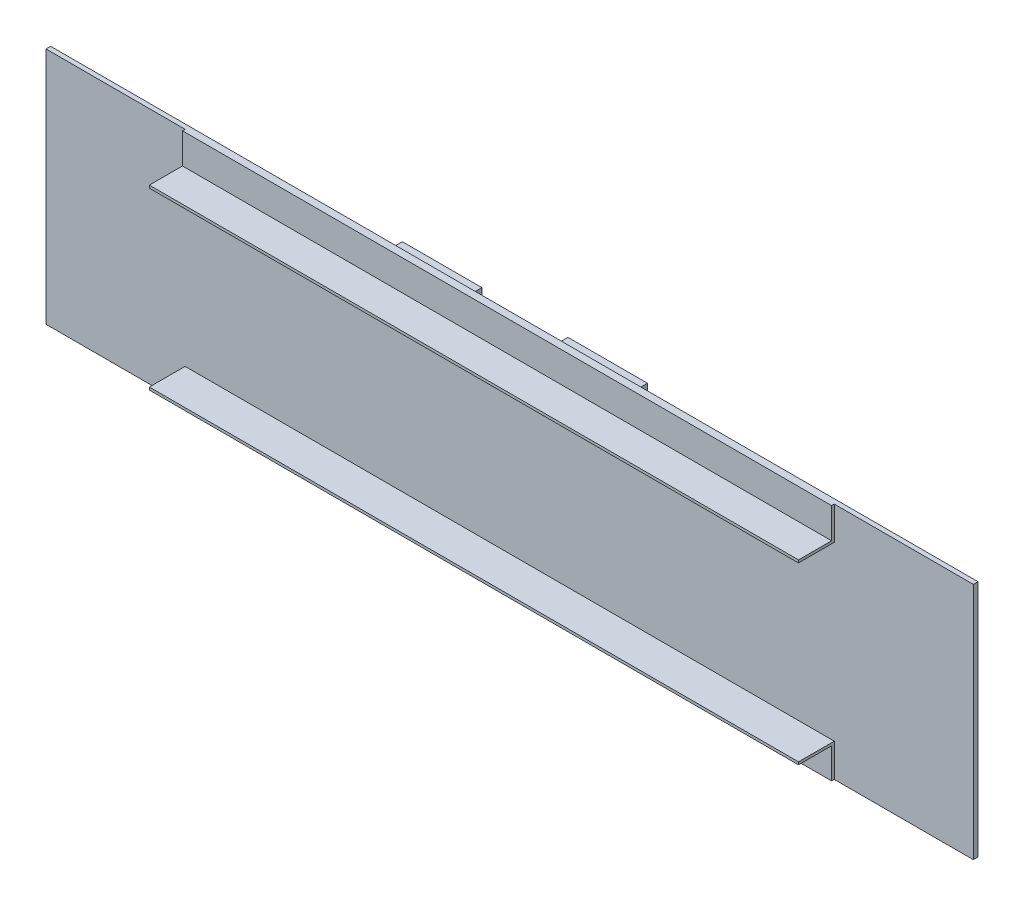
from build123d import *

# Parameters (mm, degrees)
SKETCH_1_W                  = 2800
SKETCH_1_H                  = 720
EXTRUDE_1_DEPTH             = 14
SKETCH_3_R                  = 13
CUT_EXTRUDE_1_DEPTH         = 1446.612672883
PATTERN_LINEAR_1_COUNT      = 3
PATTERN_LINEAR_1_PITCH      = 80
PATTERN_LINEAR_1_COUNT_DIR2 = 4
PATTERN_LINEAR_1_PITCH_DIR2 = 80
SKETCH_4_R                  = 13
CUT_EXTRUDE_2_DEPTH         = 1446.612672883
PATTERN_LINEAR_2_COUNT      = 2
PATTERN_LINEAR_2_PITCH      = 80
MIRROR_1_COPY_1_SKETCH_R    = 13
MIRROR_1_COPY_1_DEPTH       = 1446.612672883
MIRROR_1_COPY_2_SKETCH_R    = 13
MIRROR_1_COPY_2_DEPTH       = 1446.612672883
MIRROR_1_COPY_3_SKETCH_R    = 13
MIRROR_1_COPY_3_DEPTH       = 1446.612672883
MIRROR_1_COPY_4_SKETCH_R    = 13
MIRROR_1_COPY_4_DEPTH       = 1446.612672883
MIRROR_1_COPY_5_SKETCH_R    = 13
MIRROR_1_COPY_5_DEPTH       = 1446.612672883
MIRROR_1_COPY_6_SKETCH_R    = 13
MIRROR_1_COPY_6_DEPTH       = 1446.612672883
MIRROR_1_COPY_7_SKETCH_R    = 13
MIRROR_1_COPY_7_DEPTH       = 1446.612672883
MIRROR_1_COPY_8_SKETCH_R    = 13
MIRROR_1_COPY_8_DEPTH       = 1446.612672883
MIRROR_1_COPY_9_SKETCH_R    = 13
MIRROR_1_COPY_9_DEPTH       = 1446.612672883
MIRROR_1_COPY_10_SKETCH_R   = 13
MIRROR_1_COPY_10_DEPTH      = 1446.612672883
MIRROR_1_COPY_11_SKETCH_R   = 13
MIRROR_1_COPY_11_DEPTH      = 1446.612672883
MIRROR_1_COPY_12_SKETCH_R   = 13
MIRROR_1_COPY_12_DEPTH      = 1446.612672883
MIRROR_2_COPY_1_SKETCH_R    = 13
MIRROR_2_COPY_1_DEPTH       = 1446.612672883
MIRROR_2_COPY_2_SKETCH_R    = 13
MIRROR_2_COPY_2_DEPTH       = 1446.612672883
MIRROR_2_COPY_3_SKETCH_R    = 13
MIRROR_2_COPY_3_DEPTH       = 1446.612672883
MIRROR_2_COPY_4_SKETCH_R    = 13
MIRROR_2_COPY_4_DEPTH       = 1446.612672883
MIRROR_2_COPY_5_SKETCH_R    = 13
MIRROR_2_COPY_5_DEPTH       = 1446.612672883
MIRROR_2_COPY_6_SKETCH_R    = 13
MIRROR_2_COPY_6_DEPTH       = 1446.612672883
MIRROR_2_COPY_7_SKETCH_R    = 13
MIRROR_2_COPY_7_DEPTH       = 1446.612672883
MIRROR_2_COPY_8_SKETCH_R    = 13
MIRROR_2_COPY_8_DEPTH       = 1446.612672883
MIRROR_2_COPY_9_SKETCH_R    = 13
MIRROR_2_COPY_9_DEPTH       = 1446.612672883
MIRROR_2_COPY_10_SKETCH_R   = 13
MIRROR_2_COPY_10_DEPTH      = 1446.612672883
MIRROR_2_COPY_11_SKETCH_R   = 13
MIRROR_2_COPY_11_DEPTH      = 1446.612672883
MIRROR_2_COPY_12_SKETCH_R   = 13
MIRROR_2_COPY_12_DEPTH      = 1446.612672883
MIRROR_2_COPY_13_SKETCH_R   = 13
MIRROR_2_COPY_13_DEPTH      = 1446.612672883
MIRROR_2_COPY_14_SKETCH_R   = 13
MIRROR_2_COPY_14_DEPTH      = 1446.612672883
MIRROR_2_COPY_15_SKETCH_R   = 13
MIRROR_2_COPY_15_DEPTH      = 1446.612672883
MIRROR_2_COPY_16_SKETCH_R   = 13
MIRROR_2_COPY_16_DEPTH      = 1446.612672883
MIRROR_2_COPY_17_SKETCH_R   = 13
MIRROR_2_COPY_17_DEPTH      = 1446.612672883
MIRROR_2_COPY_18_SKETCH_R   = 13
MIRROR_2_COPY_18_DEPTH      = 1446.612672883
MIRROR_2_COPY_19_SKETCH_R   = 13
MIRROR_2_COPY_19_DEPTH      = 1446.612672883
MIRROR_2_COPY_20_SKETCH_R   = 13
MIRROR_2_COPY_20_DEPTH      = 1446.612672883
MIRROR_2_COPY_21_SKETCH_R   = 13
MIRROR_2_COPY_21_DEPTH      = 1446.612672883
MIRROR_2_COPY_22_SKETCH_R   = 13
MIRROR_2_COPY_22_DEPTH      = 1446.612672883
MIRROR_2_COPY_23_SKETCH_R   = 13
MIRROR_2_COPY_23_DEPTH      = 1446.612672883
MIRROR_2_COPY_24_SKETCH_R   = 13
MIRROR_2_COPY_24_DEPTH      = 1446.612672883
MIRROR_2_COPY_25_SKETCH_R   = 13
MIRROR_2_COPY_25_DEPTH      = 1446.612672883
MIRROR_2_COPY_26_SKETCH_R   = 13
MIRROR_2_COPY_26_DEPTH      = 1446.612672883
SKETCH_5_W                  = 980
SKETCH_5_H                  = 100
EXTRUDE_2_DEPTH             = 8
SKETCH_7_R                  = 13
CUT_EXTRUDE_3_DEPTH         = 1446.712281196
PATTERN_LINEAR_3_COUNT      = 5
PATTERN_LINEAR_3_PITCH      = 80
SKETCH_8_R                  = 13
CUT_EXTRUDE_4_DEPTH         = 1446.712281196
SKETCH_9_W                  = 980
SKETCH_9_H                  = 8
EXTRUDE_3_DEPTH             = 100
MIRROR_3_COPY_1_SKETCH_R    = 13
MIRROR_3_COPY_1_DEPTH       = 1446.712281196
MIRROR_3_COPY_2_SKETCH_R    = 13
MIRROR_3_COPY_2_DEPTH       = 1446.712281196
MIRROR_3_COPY_3_SKETCH_R    = 13
MIRROR_3_COPY_3_DEPTH       = 1446.712281196
MIRROR_3_COPY_4_SKETCH_R    = 13
MIRROR_3_COPY_4_DEPTH       = 1446.712281196
MIRROR_4_COPY_1_SKETCH_R    = 13
MIRROR_4_COPY_1_DEPTH       = 1446.712281196
MIRROR_4_COPY_2_SKETCH_R    = 13
MIRROR_4_COPY_2_DEPTH       = 1446.712281196
MIRROR_4_COPY_3_SKETCH_R    = 13
MIRROR_4_COPY_3_DEPTH       = 1446.712281196
MIRROR_4_COPY_4_SKETCH_R    = 13
MIRROR_4_COPY_4_DEPTH       = 1446.712281196
MIRROR_4_COPY_5_SKETCH_W    = 980
MIRROR_4_COPY_5_SKETCH_H    = 100
MIRROR_4_COPY_5_DEPTH       = 8
MIRROR_4_COPY_6_SKETCH_R    = 13
MIRROR_4_COPY_6_DEPTH       = 1446.712281196
MIRROR_4_COPY_7_SKETCH_R    = 13
MIRROR_4_COPY_7_DEPTH       = 1446.712281196
MIRROR_4_COPY_8_SKETCH_W    = 980
MIRROR_4_COPY_8_SKETCH_H    = 8
MIRROR_4_COPY_8_DEPTH       = 100
MIRROR_4_COPY_9_SKETCH_R    = 13
MIRROR_4_COPY_9_DEPTH       = 1446.712281196
MIRROR_4_COPY_10_SKETCH_R   = 13
MIRROR_4_COPY_10_DEPTH      = 1446.712281196
MIRROR_4_COPY_11_SKETCH_R   = 13
MIRROR_4_COPY_11_DEPTH      = 1446.712281196
MIRROR_4_COPY_12_SKETCH_R   = 13
MIRROR_4_COPY_12_DEPTH      = 1446.712281196
SKETCH_11_W                 = 240
SKETCH_11_H                 = 80
EXTRUDE_4_DEPTH             = 32
SKETCH_12_R                 = 13
CUT_EXTRUDE_5_DEPTH         = 1449.999654934
PATTERN_LINEAR_4_COUNT      = 3
PATTERN_LINEAR_4_PITCH      = 80
SKETCH_11_3_W               = 240
SKETCH_11_3_H               = 80
EXTRUDE_6_DEPTH             = 54
SKETCH_13_R                 = 13
CUT_EXTRUDE_6_DEPTH         = 1449.999654934
PATTERN_LINEAR_5_COUNT      = 3
PATTERN_LINEAR_5_PITCH      = 80
MIRROR_7_COPY_1_SKETCH_R    = 13
MIRROR_7_COPY_1_DEPTH       = 1449.999654934
MIRROR_7_COPY_2_SKETCH_R    = 13
MIRROR_7_COPY_2_DEPTH       = 1449.999654934
MIRROR_8_COPY_1_SKETCH_R    = 13
MIRROR_8_COPY_1_DEPTH       = 1449.999654934
MIRROR_8_COPY_2_SKETCH_R    = 13
MIRROR_8_COPY_2_DEPTH       = 1449.999654934
MIRROR_8_COPY_3_SKETCH_W    = 240
MIRROR_8_COPY_3_SKETCH_H    = 80
MIRROR_8_COPY_3_DEPTH       = 54
MIRROR_8_COPY_4_SKETCH_R    = 13
MIRROR_8_COPY_4_DEPTH       = 1449.999654934
MIRROR_8_COPY_5_SKETCH_R    = 13
MIRROR_8_COPY_5_DEPTH       = 1449.999654934
MIRROR_8_COPY_6_SKETCH_R    = 13
MIRROR_8_COPY_6_DEPTH       = 1449.999654934
SKETCH_14_W                 = 2800
SKETCH_14_H                 = 720
EXTRUDE_7_DEPTH             = 14
SKETCH_15_W                 = 1960
SKETCH_15_H                 = 100
EXTRUDE_8_DEPTH             = 8
SKETCH_16_W                 = 240
SKETCH_16_H                 = 80
EXTRUDE_9_DEPTH             = 32


with BuildPart() as part:
    # 草图1 → 凸台-拉伸1 (new body)
    with BuildSketch(Plane.XY):
        Rectangle(SKETCH_1_W, SKETCH_1_H)
    extrude(amount=EXTRUDE_1_DEPTH)

    # 草图3 → 切除-拉伸1 (cut, through all)
    with BuildSketch(Plane.XY.offset(14)):
        with Locations((-1330.210648338, 299.636572569)):
            Circle(SKETCH_3_R)
    cut_extrude_1 = extrude(amount=-CUT_EXTRUDE_1_DEPTH, mode=Mode.SUBTRACT)

    # 阵列(线性)1: Cut-Extrude 1 3 × 4
    with Locations(*[(i * PATTERN_LINEAR_1_PITCH, -j * PATTERN_LINEAR_1_PITCH_DIR2, 0) for i in range(PATTERN_LINEAR_1_COUNT) for j in range(PATTERN_LINEAR_1_COUNT_DIR2) if (i, j) != (0, 0)]):
        add(cut_extrude_1, mode=Mode.SUBTRACT)

    # 草图4 → 切除-拉伸2 (cut, through all)
    with BuildSketch(Plane.XY.offset(14)):
        with Locations((-1030.029167404, 300.016103943)):
            Circle(SKETCH_4_R)
    cut_extrude_2 = extrude(amount=-CUT_EXTRUDE_2_DEPTH, mode=Mode.SUBTRACT)

    # 阵列(线性)2: 切除-拉伸2 ×2
    with Locations(*[(0, -i * PATTERN_LINEAR_2_PITCH, 0) for i in range(1, PATTERN_LINEAR_2_COUNT)]):
        add(cut_extrude_2, mode=Mode.SUBTRACT)

    # 镜向1: 切除-拉伸1, 切除-拉伸2 across plane
    add(cut_extrude_1.mirror(Plane.ZX), mode=Mode.SUBTRACT)
    add(cut_extrude_2.mirror(Plane.ZX), mode=Mode.SUBTRACT)

    # 镜向1 copy 1 sketch → 镜向1 copy 1 (cut, through all)
    with BuildSketch(Plane(origin=(0, 80, 14), x_dir=(1, 0, 0), z_dir=(0, 0, 1))):
        with Locations((-1330.210648338, -299.636572569)):
            Circle(MIRROR_1_COPY_1_SKETCH_R)
    extrude(amount=-MIRROR_1_COPY_1_DEPTH, mode=Mode.SUBTRACT)

    # 镜向1 copy 2 sketch → 镜向1 copy 2 (cut, through all)
    with BuildSketch(Plane(origin=(0, 160, 14), x_dir=(1, 0, 0), z_dir=(0, 0, 1))):
        with Locations((-1330.210648338, -299.636572569)):
            Circle(MIRROR_1_COPY_2_SKETCH_R)
    extrude(amount=-MIRROR_1_COPY_2_DEPTH, mode=Mode.SUBTRACT)

    # 镜向1 copy 3 sketch → 镜向1 copy 3 (cut, through all)
    with BuildSketch(Plane(origin=(0, 240, 14), x_dir=(1, 0, 0), z_dir=(0, 0, 1))):
        with Locations((-1330.210648338, -299.636572569)):
            Circle(MIRROR_1_COPY_3_SKETCH_R)
    extrude(amount=-MIRROR_1_COPY_3_DEPTH, mode=Mode.SUBTRACT)

    # 镜向1 copy 4 sketch → 镜向1 copy 4 (cut, through all)
    with BuildSketch(Plane(origin=(80, 0, 14), x_dir=(1, 0, 0), z_dir=(0, 0, 1))):
        with Locations((-1330.210648338, -299.636572569)):
            Circle(MIRROR_1_COPY_4_SKETCH_R)
    extrude(amount=-MIRROR_1_COPY_4_DEPTH, mode=Mode.SUBTRACT)

    # 镜向1 copy 5 sketch → 镜向1 copy 5 (cut, through all)
    with BuildSketch(Plane(origin=(80, 80, 14), x_dir=(1, 0, 0), z_dir=(0, 0, 1))):
        with Locations((-1330.210648338, -299.636572569)):
            Circle(MIRROR_1_COPY_5_SKETCH_R)
    extrude(amount=-MIRROR_1_COPY_5_DEPTH, mode=Mode.SUBTRACT)

    # 镜向1 copy 6 sketch → 镜向1 copy 6 (cut, through all)
    with BuildSketch(Plane(origin=(80, 160, 14), x_dir=(1, 0, 0), z_dir=(0, 0, 1))):
        with Locations((-1330.210648338, -299.636572569)):
            Circle(MIRROR_1_COPY_6_SKETCH_R)
    extrude(amount=-MIRROR_1_COPY_6_DEPTH, mode=Mode.SUBTRACT)

    # 镜向1 copy 7 sketch → 镜向1 copy 7 (cut, through all)
    with BuildSketch(Plane(origin=(80, 240, 14), x_dir=(1, 0, 0), z_dir=(0, 0, 1))):
        with Locations((-1330.210648338, -299.636572569)):
            Circle(MIRROR_1_COPY_7_SKETCH_R)
    extrude(amount=-MIRROR_1_COPY_7_DEPTH, mode=Mode.SUBTRACT)

    # 镜向1 copy 8 sketch → 镜向1 copy 8 (cut, through all)
    with BuildSketch(Plane(origin=(160, 0, 14), x_dir=(1, 0, 0), z_dir=(0, 0, 1))):
        with Locations((-1330.210648338, -299.636572569)):
            Circle(MIRROR_1_COPY_8_SKETCH_R)
    extrude(amount=-MIRROR_1_COPY_8_DEPTH, mode=Mode.SUBTRACT)

    # 镜向1 copy 9 sketch → 镜向1 copy 9 (cut, through all)
    with BuildSketch(Plane(origin=(160, 80, 14), x_dir=(1, 0, 0), z_dir=(0, 0, 1))):
        with Locations((-1330.210648338, -299.636572569)):
            Circle(MIRROR_1_COPY_9_SKETCH_R)
    extrude(amount=-MIRROR_1_COPY_9_DEPTH, mode=Mode.SUBTRACT)

    # 镜向1 copy 10 sketch → 镜向1 copy 10 (cut, through all)
    with BuildSketch(Plane(origin=(160, 160, 14), x_dir=(1, 0, 0), z_dir=(0, 0, 1))):
        with Locations((-1330.210648338, -299.636572569)):
            Circle(MIRROR_1_COPY_10_SKETCH_R)
    extrude(amount=-MIRROR_1_COPY_10_DEPTH, mode=Mode.SUBTRACT)

    # 镜向1 copy 11 sketch → 镜向1 copy 11 (cut, through all)
    with BuildSketch(Plane(origin=(160, 240, 14), x_dir=(1, 0, 0), z_dir=(0, 0, 1))):
        with Locations((-1330.210648338, -299.636572569)):
            Circle(MIRROR_1_COPY_11_SKETCH_R)
    extrude(amount=-MIRROR_1_COPY_11_DEPTH, mode=Mode.SUBTRACT)

    # 镜向1 copy 12 sketch → 镜向1 copy 12 (cut, through all)
    with BuildSketch(Plane(origin=(0, 80, 14), x_dir=(1, 0, 0), z_dir=(0, 0, 1))):
        with Locations((-1030.029167404, -300.016103943)):
            Circle(MIRROR_1_COPY_12_SKETCH_R)
    extrude(amount=-MIRROR_1_COPY_12_DEPTH, mode=Mode.SUBTRACT)

    # 镜向2: 切除-拉伸1, 切除-拉伸2 across plane
    add(cut_extrude_1.mirror(Plane(origin=(0, 0, 0), x_dir=(0, 0, 1), z_dir=(1, 0, 0))), mode=Mode.SUBTRACT)
    add(cut_extrude_2.mirror(Plane(origin=(0, 0, 0), x_dir=(0, 0, 1), z_dir=(1, 0, 0))), mode=Mode.SUBTRACT)

    # 镜向2 copy 1 sketch → 镜向2 copy 1 (cut, through all)
    with BuildSketch(Plane(origin=(0, -80, 14), x_dir=(-1, 0, 0), z_dir=(0, 0, 1))):
        with Locations((-1330.210648338, -299.636572569)):
            Circle(MIRROR_2_COPY_1_SKETCH_R)
    extrude(amount=-MIRROR_2_COPY_1_DEPTH, mode=Mode.SUBTRACT)

    # 镜向2 copy 2 sketch → 镜向2 copy 2 (cut, through all)
    with BuildSketch(Plane(origin=(0, -160, 14), x_dir=(-1, 0, 0), z_dir=(0, 0, 1))):
        with Locations((-1330.210648338, -299.636572569)):
            Circle(MIRROR_2_COPY_2_SKETCH_R)
    extrude(amount=-MIRROR_2_COPY_2_DEPTH, mode=Mode.SUBTRACT)

    # 镜向2 copy 3 sketch → 镜向2 copy 3 (cut, through all)
    with BuildSketch(Plane(origin=(0, -240, 14), x_dir=(-1, 0, 0), z_dir=(0, 0, 1))):
        with Locations((-1330.210648338, -299.636572569)):
            Circle(MIRROR_2_COPY_3_SKETCH_R)
    extrude(amount=-MIRROR_2_COPY_3_DEPTH, mode=Mode.SUBTRACT)

    # 镜向2 copy 4 sketch → 镜向2 copy 4 (cut, through all)
    with BuildSketch(Plane(origin=(-80, 0, 14), x_dir=(-1, 0, 0), z_dir=(0, 0, 1))):
        with Locations((-1330.210648338, -299.636572569)):
            Circle(MIRROR_2_COPY_4_SKETCH_R)
    extrude(amount=-MIRROR_2_COPY_4_DEPTH, mode=Mode.SUBTRACT)

    # 镜向2 copy 5 sketch → 镜向2 copy 5 (cut, through all)
    with BuildSketch(Plane(origin=(-80, -80, 14), x_dir=(-1, 0, 0), z_dir=(0, 0, 1))):
        with Locations((-1330.210648338, -299.636572569)):
            Circle(MIRROR_2_COPY_5_SKETCH_R)
    extrude(amount=-MIRROR_2_COPY_5_DEPTH, mode=Mode.SUBTRACT)

    # 镜向2 copy 6 sketch → 镜向2 copy 6 (cut, through all)
    with BuildSketch(Plane(origin=(-80, -160, 14), x_dir=(-1, 0, 0), z_dir=(0, 0, 1))):
        with Locations((-1330.210648338, -299.636572569)):
            Circle(MIRROR_2_COPY_6_SKETCH_R)
    extrude(amount=-MIRROR_2_COPY_6_DEPTH, mode=Mode.SUBTRACT)

    # 镜向2 copy 7 sketch → 镜向2 copy 7 (cut, through all)
    with BuildSketch(Plane(origin=(-80, -240, 14), x_dir=(-1, 0, 0), z_dir=(0, 0, 1))):
        with Locations((-1330.210648338, -299.636572569)):
            Circle(MIRROR_2_COPY_7_SKETCH_R)
    extrude(amount=-MIRROR_2_COPY_7_DEPTH, mode=Mode.SUBTRACT)

    # 镜向2 copy 8 sketch → 镜向2 copy 8 (cut, through all)
    with BuildSketch(Plane(origin=(-160, 0, 14), x_dir=(-1, 0, 0), z_dir=(0, 0, 1))):
        with Locations((-1330.210648338, -299.636572569)):
            Circle(MIRROR_2_COPY_8_SKETCH_R)
    extrude(amount=-MIRROR_2_COPY_8_DEPTH, mode=Mode.SUBTRACT)

    # 镜向2 copy 9 sketch → 镜向2 copy 9 (cut, through all)
    with BuildSketch(Plane(origin=(-160, -80, 14), x_dir=(-1, 0, 0), z_dir=(0, 0, 1))):
        with Locations((-1330.210648338, -299.636572569)):
            Circle(MIRROR_2_COPY_9_SKETCH_R)
    extrude(amount=-MIRROR_2_COPY_9_DEPTH, mode=Mode.SUBTRACT)

    # 镜向2 copy 10 sketch → 镜向2 copy 10 (cut, through all)
    with BuildSketch(Plane(origin=(-160, -160, 14), x_dir=(-1, 0, 0), z_dir=(0, 0, 1))):
        with Locations((-1330.210648338, -299.636572569)):
            Circle(MIRROR_2_COPY_10_SKETCH_R)
    extrude(amount=-MIRROR_2_COPY_10_DEPTH, mode=Mode.SUBTRACT)

    # 镜向2 copy 11 sketch → 镜向2 copy 11 (cut, through all)
    with BuildSketch(Plane(origin=(-160, -240, 14), x_dir=(-1, 0, 0), z_dir=(0, 0, 1))):
        with Locations((-1330.210648338, -299.636572569)):
            Circle(MIRROR_2_COPY_11_SKETCH_R)
    extrude(amount=-MIRROR_2_COPY_11_DEPTH, mode=Mode.SUBTRACT)

    # 镜向2 copy 12 sketch → 镜向2 copy 12 (cut, through all)
    with BuildSketch(Plane(origin=(0, -80, 14), x_dir=(-1, 0, 0), z_dir=(0, 0, 1))):
        with Locations((-1030.029167404, -300.016103943)):
            Circle(MIRROR_2_COPY_12_SKETCH_R)
    extrude(amount=-MIRROR_2_COPY_12_DEPTH, mode=Mode.SUBTRACT)

    # 镜向2 copy 13 sketch → 镜向2 copy 13 (cut, through all)
    with BuildSketch(Plane(origin=(0, 0, 14), x_dir=(-1, 0, 0), z_dir=(0, 0, 1))):
        with Locations((-1330.210648338, 299.636572569)):
            Circle(MIRROR_2_COPY_13_SKETCH_R)
    extrude(amount=-MIRROR_2_COPY_13_DEPTH, mode=Mode.SUBTRACT)

    # 镜向2 copy 14 sketch → 镜向2 copy 14 (cut, through all)
    with BuildSketch(Plane(origin=(0, 0, 14), x_dir=(-1, 0, 0), z_dir=(0, 0, 1))):
        with Locations((-1030.029167404, 300.016103943)):
            Circle(MIRROR_2_COPY_14_SKETCH_R)
    extrude(amount=-MIRROR_2_COPY_14_DEPTH, mode=Mode.SUBTRACT)

    # 镜向2 copy 15 sketch → 镜向2 copy 15 (cut, through all)
    with BuildSketch(Plane(origin=(0, 80, 14), x_dir=(-1, 0, 0), z_dir=(0, 0, 1))):
        with Locations((-1330.210648338, 299.636572569)):
            Circle(MIRROR_2_COPY_15_SKETCH_R)
    extrude(amount=-MIRROR_2_COPY_15_DEPTH, mode=Mode.SUBTRACT)

    # 镜向2 copy 16 sketch → 镜向2 copy 16 (cut, through all)
    with BuildSketch(Plane(origin=(0, 160, 14), x_dir=(-1, 0, 0), z_dir=(0, 0, 1))):
        with Locations((-1330.210648338, 299.636572569)):
            Circle(MIRROR_2_COPY_16_SKETCH_R)
    extrude(amount=-MIRROR_2_COPY_16_DEPTH, mode=Mode.SUBTRACT)

    # 镜向2 copy 17 sketch → 镜向2 copy 17 (cut, through all)
    with BuildSketch(Plane(origin=(0, 240, 14), x_dir=(-1, 0, 0), z_dir=(0, 0, 1))):
        with Locations((-1330.210648338, 299.636572569)):
            Circle(MIRROR_2_COPY_17_SKETCH_R)
    extrude(amount=-MIRROR_2_COPY_17_DEPTH, mode=Mode.SUBTRACT)

    # 镜向2 copy 18 sketch → 镜向2 copy 18 (cut, through all)
    with BuildSketch(Plane(origin=(-80, 0, 14), x_dir=(-1, 0, 0), z_dir=(0, 0, 1))):
        with Locations((-1330.210648338, 299.636572569)):
            Circle(MIRROR_2_COPY_18_SKETCH_R)
    extrude(amount=-MIRROR_2_COPY_18_DEPTH, mode=Mode.SUBTRACT)

    # 镜向2 copy 19 sketch → 镜向2 copy 19 (cut, through all)
    with BuildSketch(Plane(origin=(-80, 80, 14), x_dir=(-1, 0, 0), z_dir=(0, 0, 1))):
        with Locations((-1330.210648338, 299.636572569)):
            Circle(MIRROR_2_COPY_19_SKETCH_R)
    extrude(amount=-MIRROR_2_COPY_19_DEPTH, mode=Mode.SUBTRACT)

    # 镜向2 copy 20 sketch → 镜向2 copy 20 (cut, through all)
    with BuildSketch(Plane(origin=(-80, 160, 14), x_dir=(-1, 0, 0), z_dir=(0, 0, 1))):
        with Locations((-1330.210648338, 299.636572569)):
            Circle(MIRROR_2_COPY_20_SKETCH_R)
    extrude(amount=-MIRROR_2_COPY_20_DEPTH, mode=Mode.SUBTRACT)

    # 镜向2 copy 21 sketch → 镜向2 copy 21 (cut, through all)
    with BuildSketch(Plane(origin=(-80, 240, 14), x_dir=(-1, 0, 0), z_dir=(0, 0, 1))):
        with Locations((-1330.210648338, 299.636572569)):
            Circle(MIRROR_2_COPY_21_SKETCH_R)
    extrude(amount=-MIRROR_2_COPY_21_DEPTH, mode=Mode.SUBTRACT)

    # 镜向2 copy 22 sketch → 镜向2 copy 22 (cut, through all)
    with BuildSketch(Plane(origin=(-160, 0, 14), x_dir=(-1, 0, 0), z_dir=(0, 0, 1))):
        with Locations((-1330.210648338, 299.636572569)):
            Circle(MIRROR_2_COPY_22_SKETCH_R)
    extrude(amount=-MIRROR_2_COPY_22_DEPTH, mode=Mode.SUBTRACT)

    # 镜向2 copy 23 sketch → 镜向2 copy 23 (cut, through all)
    with BuildSketch(Plane(origin=(-160, 80, 14), x_dir=(-1, 0, 0), z_dir=(0, 0, 1))):
        with Locations((-1330.210648338, 299.636572569)):
            Circle(MIRROR_2_COPY_23_SKETCH_R)
    extrude(amount=-MIRROR_2_COPY_23_DEPTH, mode=Mode.SUBTRACT)

    # 镜向2 copy 24 sketch → 镜向2 copy 24 (cut, through all)
    with BuildSketch(Plane(origin=(-160, 160, 14), x_dir=(-1, 0, 0), z_dir=(0, 0, 1))):
        with Locations((-1330.210648338, 299.636572569)):
            Circle(MIRROR_2_COPY_24_SKETCH_R)
    extrude(amount=-MIRROR_2_COPY_24_DEPTH, mode=Mode.SUBTRACT)

    # 镜向2 copy 25 sketch → 镜向2 copy 25 (cut, through all)
    with BuildSketch(Plane(origin=(-160, 240, 14), x_dir=(-1, 0, 0), z_dir=(0, 0, 1))):
        with Locations((-1330.210648338, 299.636572569)):
            Circle(MIRROR_2_COPY_25_SKETCH_R)
    extrude(amount=-MIRROR_2_COPY_25_DEPTH, mode=Mode.SUBTRACT)

    # 镜向2 copy 26 sketch → 镜向2 copy 26 (cut, through all)
    with BuildSketch(Plane(origin=(0, 80, 14), x_dir=(-1, 0, 0), z_dir=(0, 0, 1))):
        with Locations((-1030.029167404, 300.016103943)):
            Circle(MIRROR_2_COPY_26_SKETCH_R)
    extrude(amount=-MIRROR_2_COPY_26_DEPTH, mode=Mode.SUBTRACT)

    # 草图5 → 凸台-拉伸2 (add)
    with BuildSketch(Plane.XY.offset(14)):
        with Locations((-490, 310)):
            Rectangle(SKETCH_5_W, SKETCH_5_H)
    extrude_2 = extrude(amount=EXTRUDE_2_DEPTH)

    # 草图7 → 切除-拉伸3 (cut, through all)
    with BuildSketch(Plane.XY.offset(22)):
        with Locations((-930, 304)):
            Circle(SKETCH_7_R)
    cut_extrude_3 = extrude(amount=-CUT_EXTRUDE_3_DEPTH, mode=Mode.SUBTRACT)

    # 阵列(线性)3: 切除-拉伸3 ×5
    with Locations(*[(i * PATTERN_LINEAR_3_PITCH, 0, 0) for i in range(1, PATTERN_LINEAR_3_COUNT)]):
        add(cut_extrude_3, mode=Mode.SUBTRACT)

    # 草图8 → 切除-拉伸4 (cut, through all)
    with BuildSketch(Plane.XY.offset(22)):
        with Locations((-450, 304)):
            Circle(SKETCH_8_R)
        with Locations((-50, 304)):
            Circle(SKETCH_8_R)
    cut_extrude_4 = extrude(amount=-CUT_EXTRUDE_4_DEPTH, mode=Mode.SUBTRACT)

    # 草图9 → 凸台-拉伸3 (add)
    with BuildSketch(Plane.XY.offset(22)):
        with Locations((-490, 264)):
            Rectangle(SKETCH_9_W, SKETCH_9_H)
    extrude_3 = extrude(amount=EXTRUDE_3_DEPTH)

    # 镜向3: 凸台-拉伸2, 切除-拉伸3, 切除-拉伸4, 凸台-拉伸3 across plane
    add(extrude_2.mirror(Plane.ZX))
    add(cut_extrude_3.mirror(Plane.ZX), mode=Mode.SUBTRACT)
    add(cut_extrude_4.mirror(Plane.ZX), mode=Mode.SUBTRACT)
    add(extrude_3.mirror(Plane.ZX))

    # 镜向3 copy 1 sketch → 镜向3 copy 1 (cut, through all)
    with BuildSketch(Plane(origin=(80, 0, 22), x_dir=(1, 0, 0), z_dir=(0, 0, 1))):
        with Locations((-930, -304)):
            Circle(MIRROR_3_COPY_1_SKETCH_R)
    extrude(amount=-MIRROR_3_COPY_1_DEPTH, mode=Mode.SUBTRACT)

    # 镜向3 copy 2 sketch → 镜向3 copy 2 (cut, through all)
    with BuildSketch(Plane(origin=(160, 0, 22), x_dir=(1, 0, 0), z_dir=(0, 0, 1))):
        with Locations((-930, -304)):
            Circle(MIRROR_3_COPY_2_SKETCH_R)
    extrude(amount=-MIRROR_3_COPY_2_DEPTH, mode=Mode.SUBTRACT)

    # 镜向3 copy 3 sketch → 镜向3 copy 3 (cut, through all)
    with BuildSketch(Plane(origin=(240, 0, 22), x_dir=(1, 0, 0), z_dir=(0, 0, 1))):
        with Locations((-930, -304)):
            Circle(MIRROR_3_COPY_3_SKETCH_R)
    extrude(amount=-MIRROR_3_COPY_3_DEPTH, mode=Mode.SUBTRACT)

    # 镜向3 copy 4 sketch → 镜向3 copy 4 (cut, through all)
    with BuildSketch(Plane(origin=(320, 0, 22), x_dir=(1, 0, 0), z_dir=(0, 0, 1))):
        with Locations((-930, -304)):
            Circle(MIRROR_3_COPY_4_SKETCH_R)
    extrude(amount=-MIRROR_3_COPY_4_DEPTH, mode=Mode.SUBTRACT)

    # 镜向4: 凸台-拉伸2, 切除-拉伸3, 切除-拉伸4, 凸台-拉伸3 across plane
    add(extrude_2.mirror(Plane(origin=(0, 0, 0), x_dir=(0, 0, 1), z_dir=(1, 0, 0))))
    add(cut_extrude_3.mirror(Plane(origin=(0, 0, 0), x_dir=(0, 0, 1), z_dir=(1, 0, 0))), mode=Mode.SUBTRACT)
    add(cut_extrude_4.mirror(Plane(origin=(0, 0, 0), x_dir=(0, 0, 1), z_dir=(1, 0, 0))), mode=Mode.SUBTRACT)
    add(extrude_3.mirror(Plane(origin=(0, 0, 0), x_dir=(0, 0, 1), z_dir=(1, 0, 0))))

    # 镜向4 copy 1 sketch → 镜向4 copy 1 (cut, through all)
    with BuildSketch(Plane(origin=(-80, 0, 22), x_dir=(-1, 0, 0), z_dir=(0, 0, 1))):
        with Locations((-930, -304)):
            Circle(MIRROR_4_COPY_1_SKETCH_R)
    extrude(amount=-MIRROR_4_COPY_1_DEPTH, mode=Mode.SUBTRACT)

    # 镜向4 copy 2 sketch → 镜向4 copy 2 (cut, through all)
    with BuildSketch(Plane(origin=(-160, 0, 22), x_dir=(-1, 0, 0), z_dir=(0, 0, 1))):
        with Locations((-930, -304)):
            Circle(MIRROR_4_COPY_2_SKETCH_R)
    extrude(amount=-MIRROR_4_COPY_2_DEPTH, mode=Mode.SUBTRACT)

    # 镜向4 copy 3 sketch → 镜向4 copy 3 (cut, through all)
    with BuildSketch(Plane(origin=(-240, 0, 22), x_dir=(-1, 0, 0), z_dir=(0, 0, 1))):
        with Locations((-930, -304)):
            Circle(MIRROR_4_COPY_3_SKETCH_R)
    extrude(amount=-MIRROR_4_COPY_3_DEPTH, mode=Mode.SUBTRACT)

    # 镜向4 copy 4 sketch → 镜向4 copy 4 (cut, through all)
    with BuildSketch(Plane(origin=(-320, 0, 22), x_dir=(-1, 0, 0), z_dir=(0, 0, 1))):
        with Locations((-930, -304)):
            Circle(MIRROR_4_COPY_4_SKETCH_R)
    extrude(amount=-MIRROR_4_COPY_4_DEPTH, mode=Mode.SUBTRACT)

    # 镜向4 copy 5 sketch → 镜向4 copy 5 (add)
    with BuildSketch(Plane(origin=(0, 0, 14), x_dir=(-1, 0, 0), z_dir=(0, 0, 1))):
        with Locations((-490, 310)):
            Rectangle(MIRROR_4_COPY_5_SKETCH_W, MIRROR_4_COPY_5_SKETCH_H)
    extrude(amount=MIRROR_4_COPY_5_DEPTH)

    # 镜向4 copy 6 sketch → 镜向4 copy 6 (cut, through all)
    with BuildSketch(Plane(origin=(0, 0, 22), x_dir=(-1, 0, 0), z_dir=(0, 0, 1))):
        with Locations((-930, 304)):
            Circle(MIRROR_4_COPY_6_SKETCH_R)
    extrude(amount=-MIRROR_4_COPY_6_DEPTH, mode=Mode.SUBTRACT)

    # 镜向4 copy 7 sketch → 镜向4 copy 7 (cut, through all)
    with BuildSketch(Plane(origin=(0, 0, 22), x_dir=(-1, 0, 0), z_dir=(0, 0, 1))):
        with Locations((-450, 304)):
            Circle(MIRROR_4_COPY_7_SKETCH_R)
        with Locations((-50, 304)):
            Circle(MIRROR_4_COPY_7_SKETCH_R)
    extrude(amount=-MIRROR_4_COPY_7_DEPTH, mode=Mode.SUBTRACT)

    # 镜向4 copy 8 sketch → 镜向4 copy 8 (add)
    with BuildSketch(Plane(origin=(0, 0, 22), x_dir=(-1, 0, 0), z_dir=(0, 0, 1))):
        with Locations((-490, 264)):
            Rectangle(MIRROR_4_COPY_8_SKETCH_W, MIRROR_4_COPY_8_SKETCH_H)
    extrude(amount=MIRROR_4_COPY_8_DEPTH)

    # 镜向4 copy 9 sketch → 镜向4 copy 9 (cut, through all)
    with BuildSketch(Plane(origin=(-80, 0, 22), x_dir=(-1, 0, 0), z_dir=(0, 0, 1))):
        with Locations((-930, 304)):
            Circle(MIRROR_4_COPY_9_SKETCH_R)
    extrude(amount=-MIRROR_4_COPY_9_DEPTH, mode=Mode.SUBTRACT)

    # 镜向4 copy 10 sketch → 镜向4 copy 10 (cut, through all)
    with BuildSketch(Plane(origin=(-160, 0, 22), x_dir=(-1, 0, 0), z_dir=(0, 0, 1))):
        with Locations((-930, 304)):
            Circle(MIRROR_4_COPY_10_SKETCH_R)
    extrude(amount=-MIRROR_4_COPY_10_DEPTH, mode=Mode.SUBTRACT)

    # 镜向4 copy 11 sketch → 镜向4 copy 11 (cut, through all)
    with BuildSketch(Plane(origin=(-240, 0, 22), x_dir=(-1, 0, 0), z_dir=(0, 0, 1))):
        with Locations((-930, 304)):
            Circle(MIRROR_4_COPY_11_SKETCH_R)
    extrude(amount=-MIRROR_4_COPY_11_DEPTH, mode=Mode.SUBTRACT)

    # 镜向4 copy 12 sketch → 镜向4 copy 12 (cut, through all)
    with BuildSketch(Plane(origin=(-320, 0, 22), x_dir=(-1, 0, 0), z_dir=(0, 0, 1))):
        with Locations((-930, 304)):
            Circle(MIRROR_4_COPY_12_SKETCH_R)
    extrude(amount=-MIRROR_4_COPY_12_DEPTH, mode=Mode.SUBTRACT)

    # 草图11 → 凸台-拉伸4 (add)
    with BuildSketch(Plane.XY.offset(22)):
        with Locations((-250, 308)):
            Rectangle(SKETCH_11_W, SKETCH_11_H)
    extrude(amount=-EXTRUDE_4_DEPTH)

    # 草图12 → 切除-拉伸5 (cut, through all)
    with BuildSketch(Plane.XY.offset(22)):
        with Locations((-330, 304)):
            Circle(SKETCH_12_R)
    cut_extrude_5 = extrude(amount=-CUT_EXTRUDE_5_DEPTH, mode=Mode.SUBTRACT)

    # 阵列(线性)4: 切除-拉伸5 ×3
    with Locations(*[(i * PATTERN_LINEAR_4_PITCH, 0, 0) for i in range(1, PATTERN_LINEAR_4_COUNT)]):
        add(cut_extrude_5, mode=Mode.SUBTRACT)

    # 草图11<3> → 凸台-拉伸6 (add)
    with BuildSketch(Plane.XY.offset(22)):
        with Locations((-250, 308)):
            Rectangle(SKETCH_11_3_W, SKETCH_11_3_H)
    extrude_6 = extrude(amount=-EXTRUDE_6_DEPTH)

    # 草图13 → 切除-拉伸6 (cut, through all)
    with BuildSketch(Plane.XY.offset(22)):
        with Locations((-330.204145294, 303.194442938)):
            Circle(SKETCH_13_R)
    cut_extrude_6 = extrude(amount=-CUT_EXTRUDE_6_DEPTH, mode=Mode.SUBTRACT)

    # 阵列(线性)5: 切除-拉伸6 ×3
    with Locations(*[(i * PATTERN_LINEAR_5_PITCH, 0, 0) for i in range(1, PATTERN_LINEAR_5_COUNT)]):
        add(cut_extrude_6, mode=Mode.SUBTRACT)

    # 镜向7: 凸台-拉伸6, 切除-拉伸6 across plane
    add(extrude_6.mirror(Plane.ZX))
    add(cut_extrude_6.mirror(Plane.ZX), mode=Mode.SUBTRACT)

    # 镜向7 copy 1 sketch → 镜向7 copy 1 (cut, through all)
    with BuildSketch(Plane(origin=(80, 0, 22), x_dir=(1, 0, 0), z_dir=(0, 0, 1))):
        with Locations((-330.204145294, -303.194442938)):
            Circle(MIRROR_7_COPY_1_SKETCH_R)
    extrude(amount=-MIRROR_7_COPY_1_DEPTH, mode=Mode.SUBTRACT)

    # 镜向7 copy 2 sketch → 镜向7 copy 2 (cut, through all)
    with BuildSketch(Plane(origin=(160, 0, 22), x_dir=(1, 0, 0), z_dir=(0, 0, 1))):
        with Locations((-330.204145294, -303.194442938)):
            Circle(MIRROR_7_COPY_2_SKETCH_R)
    extrude(amount=-MIRROR_7_COPY_2_DEPTH, mode=Mode.SUBTRACT)

    # 镜向8: 凸台-拉伸6, 切除-拉伸6 across plane
    add(extrude_6.mirror(Plane(origin=(0, 0, 0), x_dir=(0, 0, 1), z_dir=(1, 0, 0))))
    add(cut_extrude_6.mirror(Plane(origin=(0, 0, 0), x_dir=(0, 0, 1), z_dir=(1, 0, 0))), mode=Mode.SUBTRACT)

    # 镜向8 copy 1 sketch → 镜向8 copy 1 (cut, through all)
    with BuildSketch(Plane(origin=(-80, 0, 22), x_dir=(-1, 0, 0), z_dir=(0, 0, 1))):
        with Locations((-330.204145294, -303.194442938)):
            Circle(MIRROR_8_COPY_1_SKETCH_R)
    extrude(amount=-MIRROR_8_COPY_1_DEPTH, mode=Mode.SUBTRACT)

    # 镜向8 copy 2 sketch → 镜向8 copy 2 (cut, through all)
    with BuildSketch(Plane(origin=(-160, 0, 22), x_dir=(-1, 0, 0), z_dir=(0, 0, 1))):
        with Locations((-330.204145294, -303.194442938)):
            Circle(MIRROR_8_COPY_2_SKETCH_R)
    extrude(amount=-MIRROR_8_COPY_2_DEPTH, mode=Mode.SUBTRACT)

    # 镜向8 copy 3 sketch → 镜向8 copy 3 (add)
    with BuildSketch(Plane(origin=(0, 0, 22), x_dir=(-1, 0, 0), z_dir=(0, 0, 1))):
        with Locations((-250, 308)):
            Rectangle(MIRROR_8_COPY_3_SKETCH_W, MIRROR_8_COPY_3_SKETCH_H)
    extrude(amount=-MIRROR_8_COPY_3_DEPTH)

    # 镜向8 copy 4 sketch → 镜向8 copy 4 (cut, through all)
    with BuildSketch(Plane(origin=(0, 0, 22), x_dir=(-1, 0, 0), z_dir=(0, 0, 1))):
        with Locations((-330.204145294, 303.194442938)):
            Circle(MIRROR_8_COPY_4_SKETCH_R)
    extrude(amount=-MIRROR_8_COPY_4_DEPTH, mode=Mode.SUBTRACT)

    # 镜向8 copy 5 sketch → 镜向8 copy 5 (cut, through all)
    with BuildSketch(Plane(origin=(-80, 0, 22), x_dir=(-1, 0, 0), z_dir=(0, 0, 1))):
        with Locations((-330.204145294, 303.194442938)):
            Circle(MIRROR_8_COPY_5_SKETCH_R)
    extrude(amount=-MIRROR_8_COPY_5_DEPTH, mode=Mode.SUBTRACT)

    # 镜向8 copy 6 sketch → 镜向8 copy 6 (cut, through all)
    with BuildSketch(Plane(origin=(-160, 0, 22), x_dir=(-1, 0, 0), z_dir=(0, 0, 1))):
        with Locations((-330.204145294, 303.194442938)):
            Circle(MIRROR_8_COPY_6_SKETCH_R)
    extrude(amount=-MIRROR_8_COPY_6_DEPTH, mode=Mode.SUBTRACT)

    # 草图14 → 凸台-拉伸7 (add)
    with BuildSketch(Plane.XY.offset(14)):
        Rectangle(SKETCH_14_W, SKETCH_14_H)
    extrude(amount=-EXTRUDE_7_DEPTH)

    # 草图15 → 凸台-拉伸8 (add)
    with BuildSketch(Plane.XY.offset(22)):
        with Locations((0, 310)):
            Rectangle(SKETCH_15_W, SKETCH_15_H)
        with Locations((0, -310)):
            Rectangle(SKETCH_15_W, SKETCH_15_H)
    extrude(amount=-EXTRUDE_8_DEPTH)

    # 草图16 → 凸台-拉伸9 (add)
    with BuildSketch(Plane(origin=(0, 0, 0), x_dir=(-1, 0, 0), z_dir=(0, 0, -1))):
        with Locations((-250, 308)):
            Rectangle(SKETCH_16_W, SKETCH_16_H)
        with Locations((250, 308)):
            Rectangle(SKETCH_16_W, SKETCH_16_H)
        with Locations((-250, -308)):
            Rectangle(SKETCH_16_W, SKETCH_16_H)
        with Locations((250, -308)):
            Rectangle(SKETCH_16_W, SKETCH_16_H)
    extrude(amount=EXTRUDE_9_DEPTH)


solid = part.part
